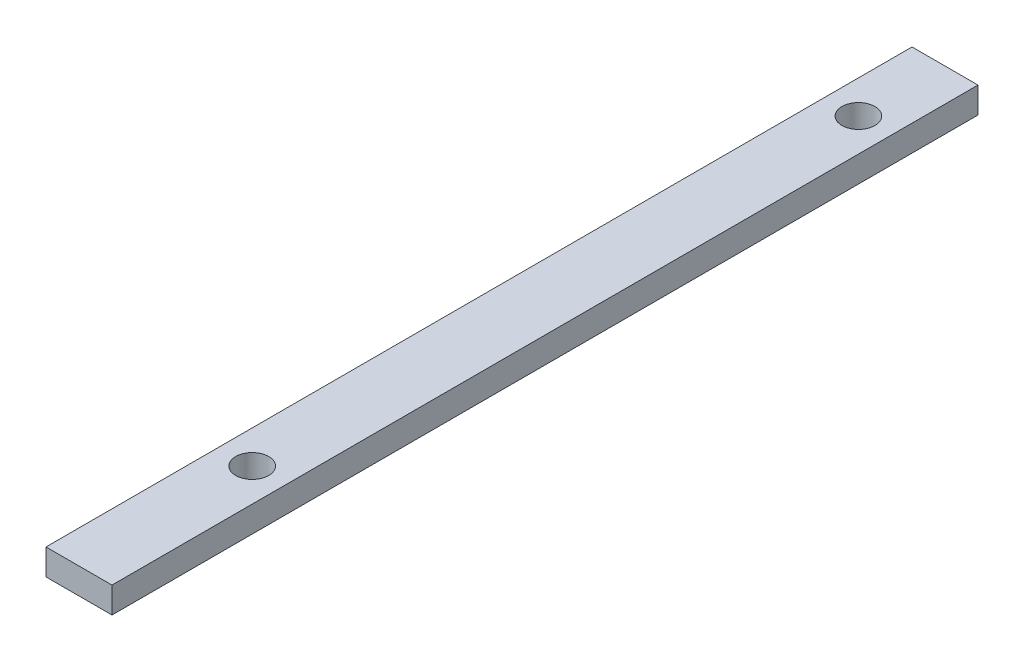
from build123d import *

# Parameters (mm, degrees)
SKETCH1_W           = 7.62
SKETCH1_H           = 100
BOSS_EXTRUDE1_DEPTH = 3
SKETCH2_R           = 1.905
CUT_EXTRUDE1_DEPTH  = 101.334761673


with BuildPart() as part:
    # Sketch1 → Boss-Extrude1 (new body)
    with BuildSketch(Plane(origin=(0, 0, 0), x_dir=(1, 0, 0), z_dir=(0, 1, 0))):
        with Locations((3.81, 50)):
            Rectangle(SKETCH1_W, SKETCH1_H)
    extrude(amount=BOSS_EXTRUDE1_DEPTH)

    # Sketch2 → Cut-Extrude1 (cut, through all)
    with BuildSketch(Plane(origin=(0, 3, 0), x_dir=(1, 0, 0), z_dir=(0, 1, 0))):
        with Locations(Location((3.81, 90, 0), (0, 0, 90))):
            Circle(SKETCH2_R)
        with Locations(Location((3.81, 20, 0), (0, 0, 270))):
            Circle(SKETCH2_R)
    extrude(amount=-CUT_EXTRUDE1_DEPTH, mode=Mode.SUBTRACT)


solid = part.part
